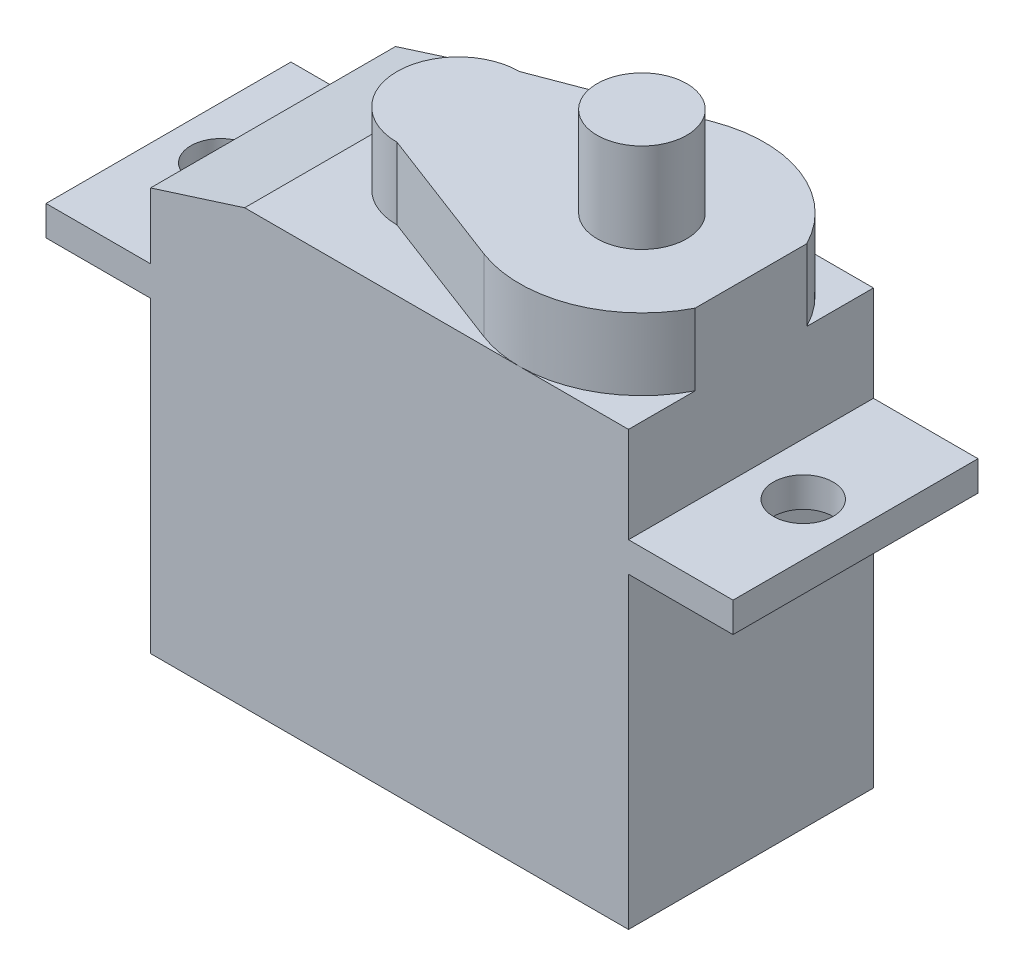
from build123d import *

# Parameters (mm, degrees)
SKETCH_1_W               = 16
SKETCH_1_H               = 8.2
EXTRUDE_1_DEPTH          = 10.3
EXTRUDE_START            = 10.3
SKETCH_2_W               = 23
SKETCH_2_H               = 8.2
EXTRUDE_2_DEPTH          = 1
SKETCH_3_W               = 16
SKETCH_3_H               = 8.2
EXTRUDE_3_DEPTH          = 14.5
SKETCH_4_R               = 1
CUT_EXTRUDE_1_DEPTH      = 14.5
EXTRUDE_4_DEPTH          = 16.9
SKETCH_7_R               = 1.5
EXTRUDE_5_DEPTH          = 19.9
CUT_EXTRUDE_2_DEPTH      = 10
CUT_EXTRUDE_2_DEPTH_BACK = 10


with BuildPart() as part:
    # 草图1 → 凸台-拉伸1 (new body)
    with BuildSketch(Plane(origin=(0, 0, 0), x_dir=(1, 0, 0), z_dir=(0, 1, 0))):
        Rectangle(SKETCH_1_W, SKETCH_1_H)
    extrude(amount=EXTRUDE_1_DEPTH)

    # 草图2 → 凸台-拉伸2 (add)
    with BuildSketch(Plane(origin=(0, 0, 0), x_dir=(1, 0, 0), z_dir=(0, 1, 0)).offset(EXTRUDE_START)):
        Rectangle(SKETCH_2_W, SKETCH_2_H)
    extrude(amount=EXTRUDE_2_DEPTH)

    # 草图3 → 凸台-拉伸3 (add)
    with BuildSketch(Plane(origin=(0, 0, 0), x_dir=(1, 0, 0), z_dir=(0, 1, 0))):
        Rectangle(SKETCH_3_W, SKETCH_3_H)
    extrude(amount=EXTRUDE_3_DEPTH)

    # 草图4 → 切除-拉伸1 (cut)
    with BuildSketch(Plane(origin=(0, 0, 0), x_dir=(1, 0, 0), z_dir=(0, 1, 0))):
        with Locations(Location((-9.75, 0, 0), (0, 0, 90))):
            Circle(SKETCH_4_R)
        with Locations(Location((9.75, 0, 0), (0, 0, 90))):
            Circle(SKETCH_4_R)
    extrude(amount=CUT_EXTRUDE_1_DEPTH, mode=Mode.SUBTRACT)

    # 草图6 → 凸台-拉伸4 (add)
    with BuildSketch(Plane(origin=(0, 0, 0), x_dir=(1, 0, 0), z_dir=(0, 1, 0))):
        with BuildLine():
            Line((8, 1.86748494), (8, -1.86748494))
            ThreePointArc((8, -1.86748494), (5.822893402, -3.826301743), (2.894290795, -3.832872384))
            Line((2.894290795, -3.832872384), (-1.8, -2.05))
            ThreePointArc((-1.8, -2.05), (-3.85, 0), (-1.8, 2.05))
            Line((-1.8, 2.05), (2.894290795, 3.832872384))
            ThreePointArc((2.894290795, 3.832872384), (5.822893402, 3.826301743), (8, 1.86748494))
        make_face()
    extrude(amount=EXTRUDE_4_DEPTH)

    # 草图7 → 凸台-拉伸5 (add)
    with BuildSketch(Plane(origin=(0, 0, 0), x_dir=(1, 0, 0), z_dir=(0, 1, 0))):
        with Locations(Location((4.35, 0, 0), (0, 0, 90))):
            Circle(SKETCH_7_R)
    extrude(amount=EXTRUDE_5_DEPTH)

    # 草图8 → 切除-拉伸2 (cut, two sides: drawn at the far end of the back side and taken through both)
    with BuildSketch(Plane.XY.offset(-CUT_EXTRUDE_2_DEPTH_BACK)):
        Polygon((-8, 14.5), (-8, 13.5), (-4.85, 14.5), align=None)
    extrude(amount=CUT_EXTRUDE_2_DEPTH + CUT_EXTRUDE_2_DEPTH_BACK, mode=Mode.SUBTRACT)


solid = part.part
